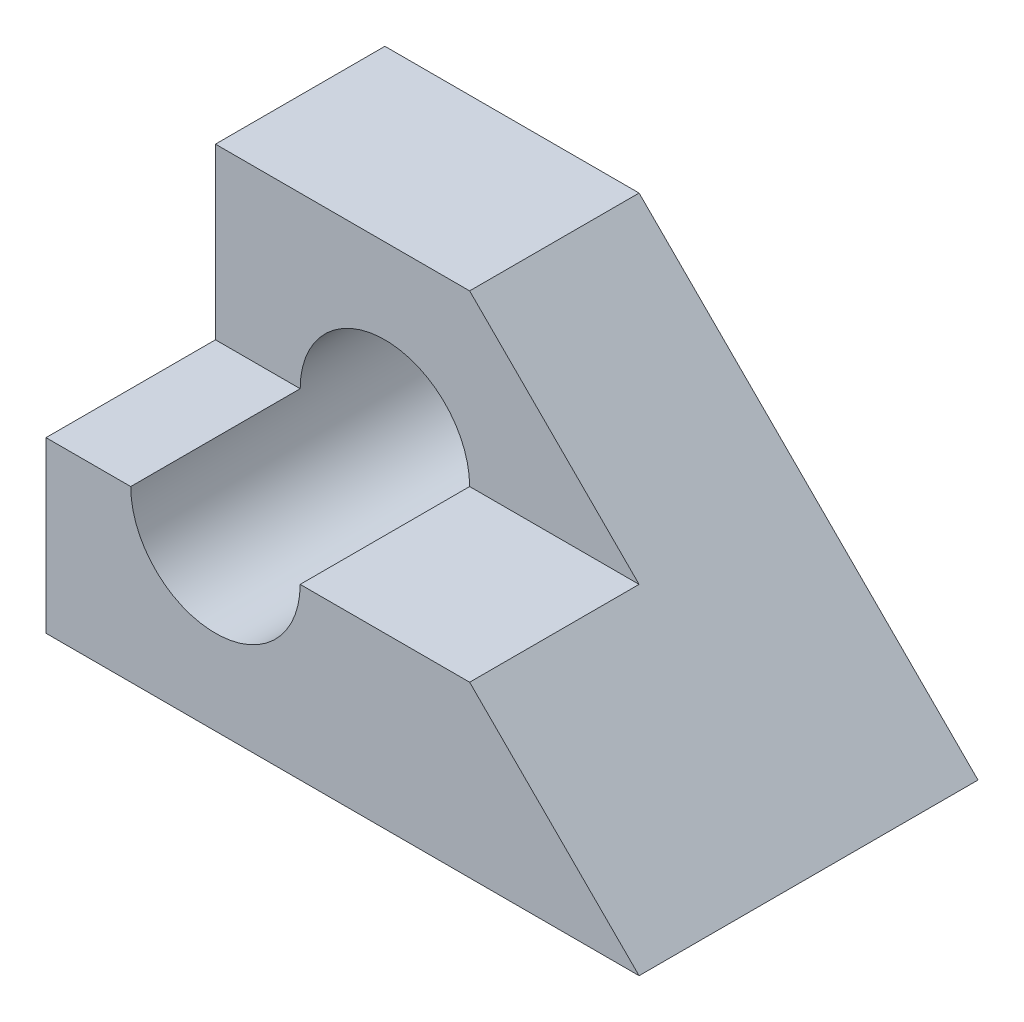
from build123d import *

# Parameters (mm, degrees)
EXTRUDE_1_DEPTH     = 70
SKETCH_3_R          = 10
CUT_EXTRUDE_1_DEPTH = 70


with BuildPart() as part:
    # 스케치1 → 보스-돌출1 (new body)
    with BuildSketch(Plane(origin=(0, 0, 0), x_dir=(0, 0, -1), z_dir=(1, 0, 0))):
        Polygon((0, 0), (40, 0), (40, 40), (20, 40), (20, 20), (0, 20), align=None)
    extrude(amount=-EXTRUDE_1_DEPTH)

    # 스케치3 → 컷-돌출1 (cut)
    with BuildSketch(Plane(origin=(0, 0, -40), x_dir=(-1, 0, 0), z_dir=(0, 0, -1))):
        with Locations((50, 20)):
            Circle(SKETCH_3_R)
        Polygon((0, 0), (40, 40), (0, 40), align=None)
    extrude(amount=-CUT_EXTRUDE_1_DEPTH, mode=Mode.SUBTRACT)


solid = part.part
